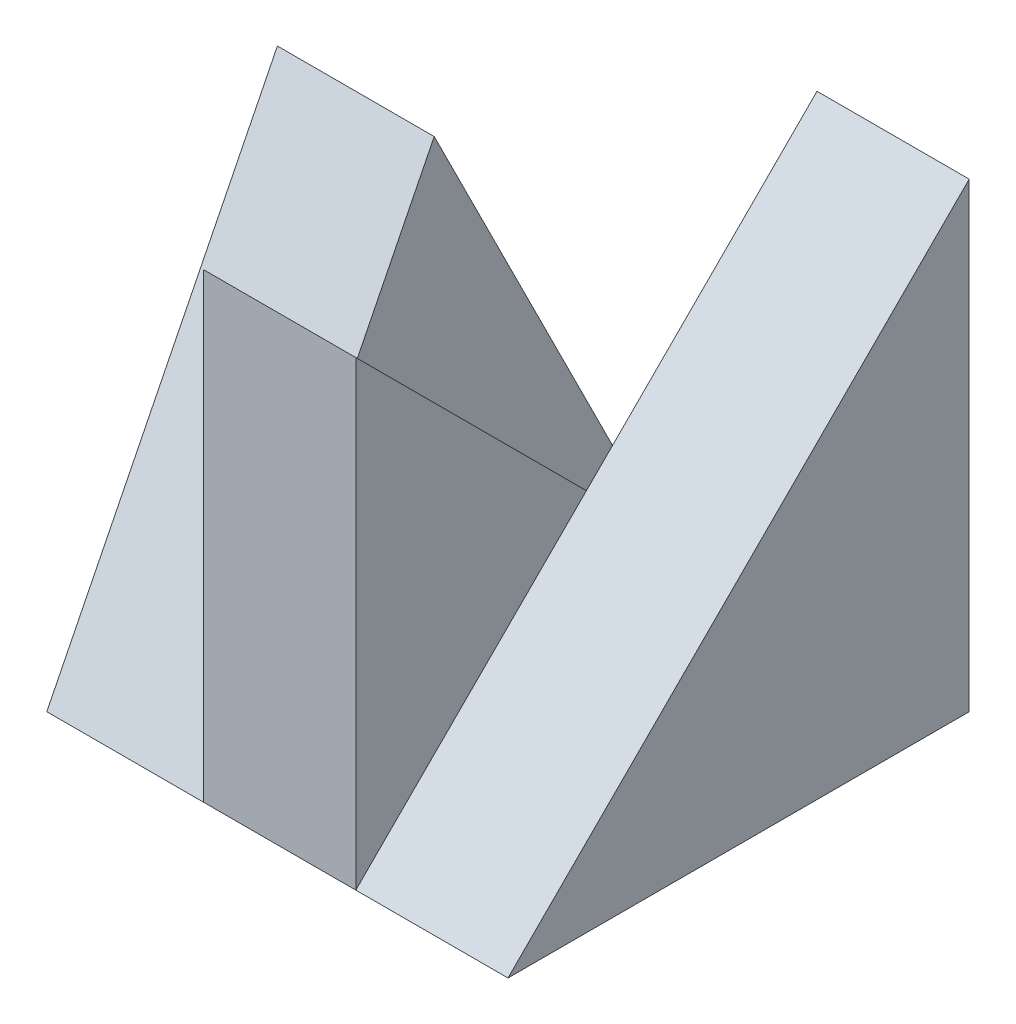
from build123d import *

# Parameters (mm, degrees)
SKETCH1_W               = 1
SKETCH1_H               = 1
BOSS_EXTRUDE1_DEPTH     = 1
CUT_EXTRUDE1_DEPTH      = 2.732050808
CUT_EXTRUDE1_DEPTH_BACK = 0.33
CUT_EXTRUDE2_DEPTH      = 0.33
CUT_EXTRUDE3_DEPTH      = 2.732050808
CUT_EXTRUDE3_DEPTH_BACK = 0.34


with BuildPart() as part:
    # Sketch1 → Boss-Extrude1 (new body)
    with BuildSketch(Plane(origin=(0, 0, 0), x_dir=(1, 0, 0), z_dir=(0, 1, 0))):
        with Locations((0.5, 0.5)):
            Rectangle(SKETCH1_W, SKETCH1_H)
    extrude(amount=BOSS_EXTRUDE1_DEPTH)

    # Sketch2 → Cut-Extrude1 (cut, two sides: drawn at the far end of the back side and taken through both)
    with BuildSketch(Plane(origin=(1, 0, 0), x_dir=(0, 0, -1), z_dir=(1, 0, 0)).offset(-CUT_EXTRUDE1_DEPTH_BACK)):
        Polygon((-9.071067812, -9.071067812), (0, 0), (1, 1), (10.071067812, 10.071067812), (-8.071067812, 28.213203436), (-27.213203436, 9.071067812), align=None)
    extrude(amount=CUT_EXTRUDE1_DEPTH + CUT_EXTRUDE1_DEPTH_BACK, mode=Mode.SUBTRACT)

    # Sketch3 → Cut-Extrude2 (cut)
    with BuildSketch(Plane(origin=(0.67, 0, 0), x_dir=(0, 0, -1), z_dir=(1, 0, 0))):
        Polygon((0, 1), (1, 0), (1, 1), align=None)
    extrude(amount=-CUT_EXTRUDE2_DEPTH, mode=Mode.SUBTRACT)

    # Sketch5 → Cut-Extrude3 (cut, two sides: drawn at the far end of the back side and taken through both)
    with BuildSketch(Plane.ZY.offset(-CUT_EXTRUDE3_DEPTH_BACK)):
        Polygon((-6.737047019, -11.474094038), (-1, 0), (-0.5, 1), (0, 0), (5.737047019, -11.474094038), (5.737047019, 14.182760211), (-6.737047019, 14.182760211), align=None)
    extrude(amount=CUT_EXTRUDE3_DEPTH + CUT_EXTRUDE3_DEPTH_BACK, mode=Mode.SUBTRACT)


solid = part.part
